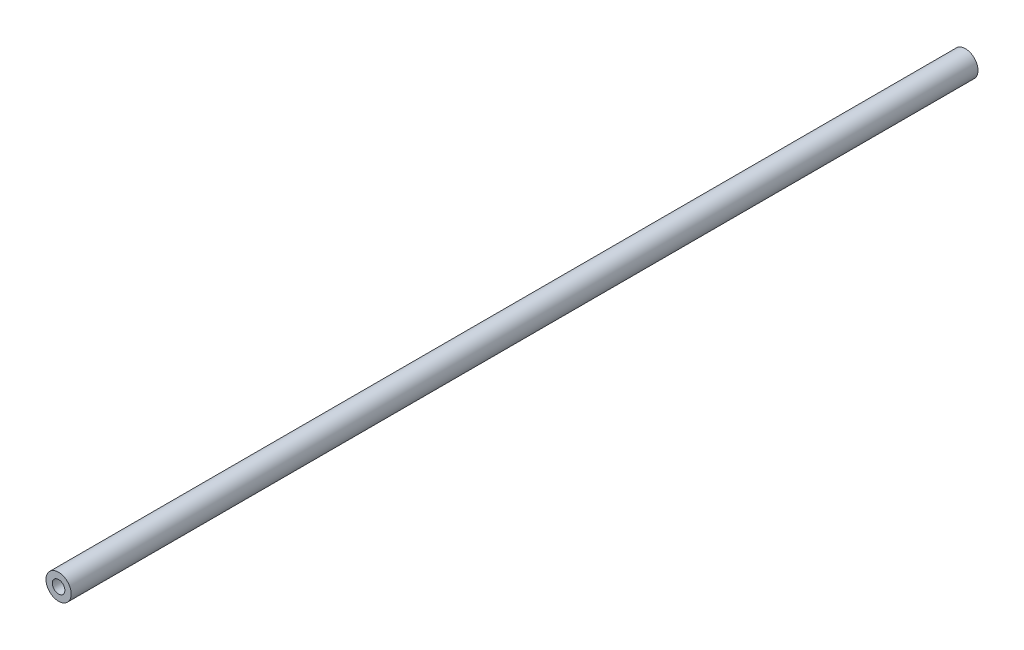
from build123d import *

# Parameters (mm, degrees)
SKETCH1_R           = 1.5875
SKETCH1_R_2         = 0.79375
BOSS_EXTRUDE1_DEPTH = 114.3


with BuildPart() as part:
    # Sketch1 → Boss-Extrude1 (new body)
    with BuildSketch(Plane.XY):
        Circle(SKETCH1_R)
        Circle(SKETCH1_R_2, mode=Mode.SUBTRACT)
    extrude(amount=BOSS_EXTRUDE1_DEPTH)


solid = part.part
